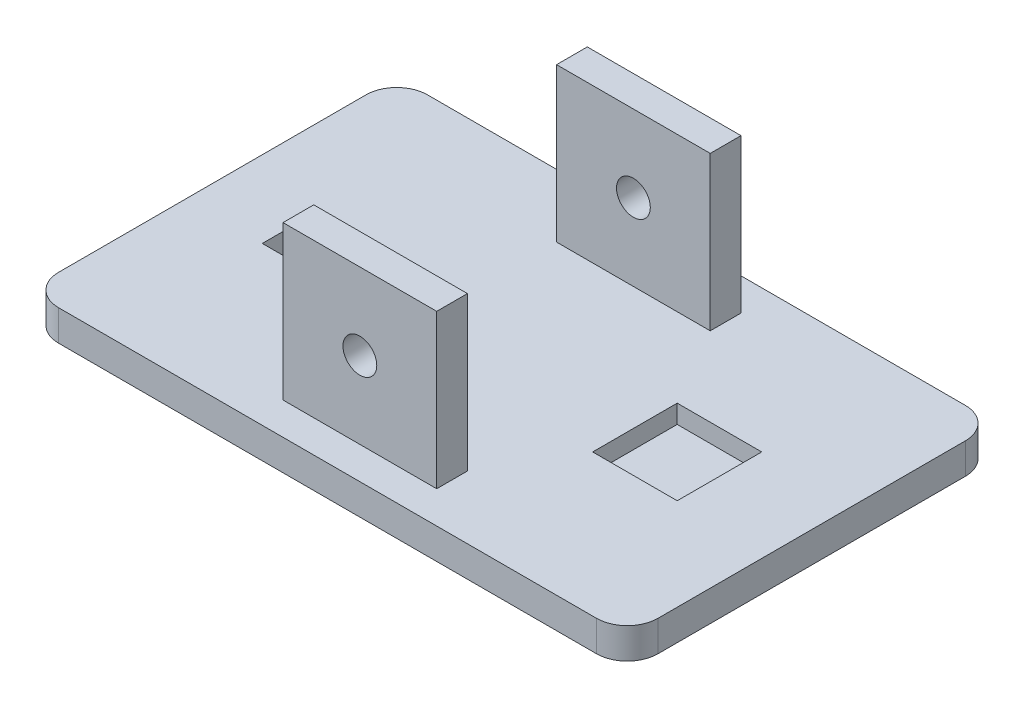
from build123d import *

# Parameters (mm, degrees)
Y_KSEKLIK_EKSTR_ZYON1_DEPTH = 2
IZIM2_W                     = 10
IZIM2_H                     = 2
Y_KSEKLIK_EKSTR_ZYON2_DEPTH = 10
IZIM3_R                     = 1.1
KES_EKSTR_ZYON1_DEPTH       = 30
IZIM4_W                     = 8
IZIM4_H                     = 3.5
KES_EKSTR_ZYON2_DEPTH       = 30
IZIM5_W                     = 5.5
IZIM5_H                     = 5.5
KES_EKSTR_ZYON3_DEPTH       = 1.2


with BuildPart() as part:
    # Çizim1 → Yükseklik-Ekstrüzyon1 (new body)
    with BuildSketch(Plane(origin=(0, 0, 0), x_dir=(1, 0, 0), z_dir=(0, 1, 0))):
        with BuildLine():
            Line((-12.738372093, 8.61627907), (22.261627907, 8.61627907))
            ThreePointArc((22.261627907, 8.61627907), (23.675841469, 8.030492632), (24.261627907, 6.61627907))
            Line((24.261627907, 6.61627907), (24.261627907, -13.38372093))
            ThreePointArc((24.261627907, -13.38372093), (23.675841469, -14.797934493), (22.261627907, -15.38372093))
            Line((22.261627907, -15.38372093), (-12.738372093, -15.38372093))
            ThreePointArc((-12.738372093, -15.38372093), (-14.152585655, -14.797934493), (-14.738372093, -13.38372093))
            Line((-14.738372093, -13.38372093), (-14.738372093, 6.61627907))
            ThreePointArc((-14.738372093, 6.61627907), (-14.152585655, 8.030492632), (-12.738372093, 8.61627907))
        make_face()
    extrude(amount=Y_KSEKLIK_EKSTR_ZYON1_DEPTH)

    # Çizim2 → Yükseklik-Ekstrüzyon2 (add)
    with BuildSketch(Plane(origin=(0, 2, 0), x_dir=(1, 0, 0), z_dir=(0, 1, 0))):
        with Locations((4.761627907, -12.28372093)):
            Rectangle(IZIM2_W, IZIM2_H)
        with Locations((4.761627907, 5.51627907)):
            Rectangle(IZIM2_W, IZIM2_H)
    extrude(amount=Y_KSEKLIK_EKSTR_ZYON2_DEPTH)

    # Çizim3 → Kes-Ekstrüzyon1 (cut)
    with BuildSketch(Plane.XY.offset(13.28372093)):
        with Locations((4.761627907, 7)):
            Circle(IZIM3_R)
    extrude(amount=-KES_EKSTR_ZYON1_DEPTH, mode=Mode.SUBTRACT)

    # Çizim4 → Kes-Ekstrüzyon2 (cut)
    with BuildSketch(Plane(origin=(0, 2, 0), x_dir=(1, 0, 0), z_dir=(0, 1, 0))):
        with Locations((-5.738372093, -3.38372093)):
            Rectangle(IZIM4_W, IZIM4_H)
    extrude(amount=-KES_EKSTR_ZYON2_DEPTH, mode=Mode.SUBTRACT)

    # Çizim5 → Kes-Ekstrüzyon3 (cut)
    with BuildSketch(Plane(origin=(0, 2, 0), x_dir=(1, 0, 0), z_dir=(0, 1, 0))):
        with Locations((15.511627907, -3.38372093)):
            Rectangle(IZIM5_W, IZIM5_H)
    extrude(amount=-KES_EKSTR_ZYON3_DEPTH, mode=Mode.SUBTRACT)


solid = part.part
